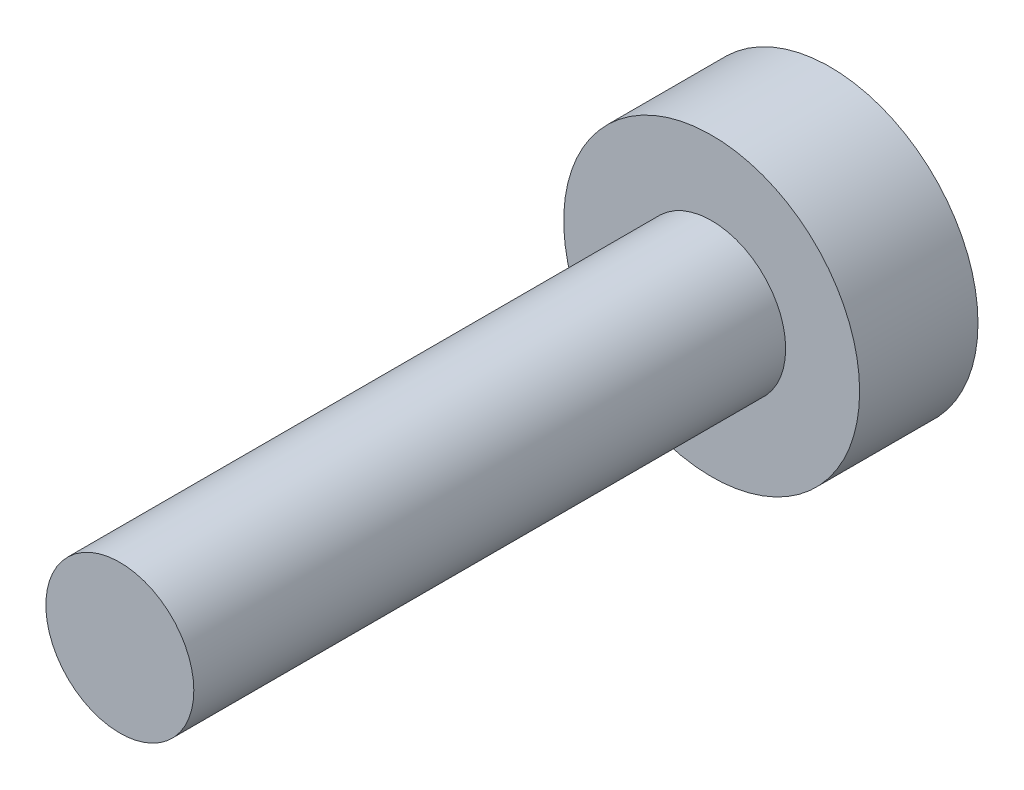
from build123d import *

# Parameters (mm, degrees)
SKETCH_1_R        = 1.25
EXTRUDE_10_DEPTH  = 10
EXTRUDE_START     = -2
SKETCH_2_R        = 2.5
EXTRUDE_315_DEPTH = 2


with BuildPart() as part:
    # 草图1 → 公称杆长10_无牙型参考 (new body)
    with BuildSketch(Plane.XY):
        Circle(SKETCH_1_R)
    extrude(amount=EXTRUDE_10_DEPTH)

    # 草图2 → Extrude 315 (add)
    with BuildSketch(Plane.XY.offset(EXTRUDE_START)):
        Circle(SKETCH_2_R)
    extrude(amount=EXTRUDE_315_DEPTH)


solid = part.part
